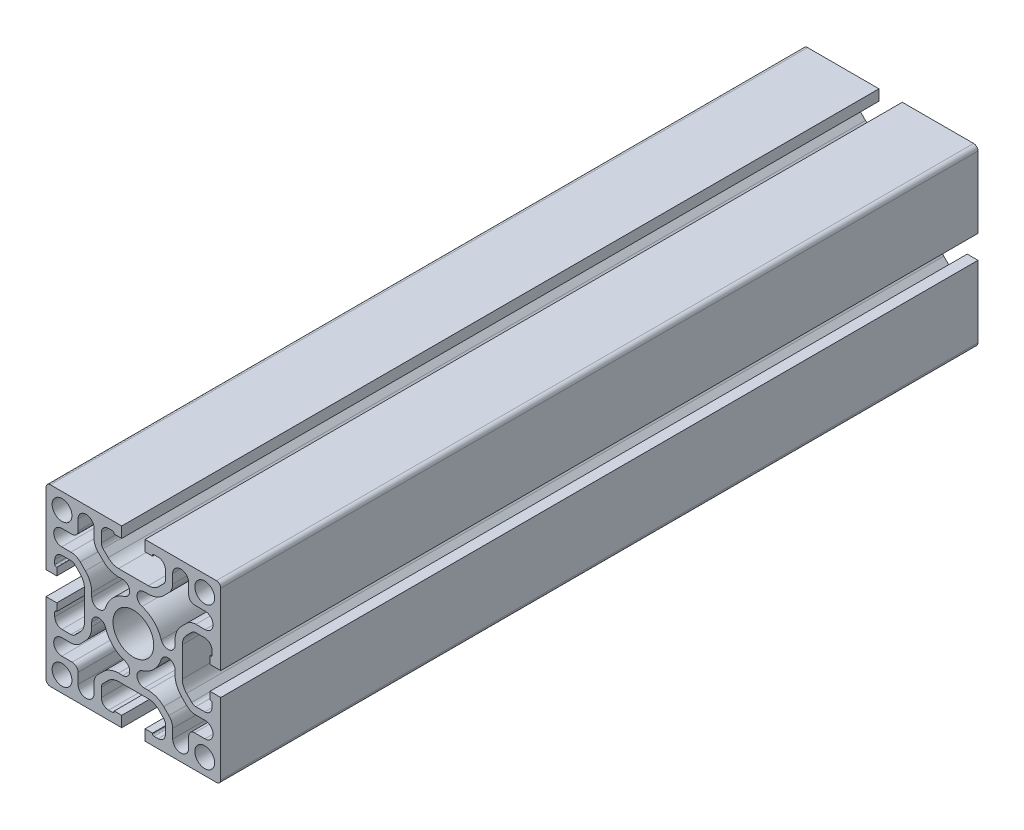
from build123d import *

# Parameters (mm, degrees)
SKETCH1_R           = 3.4
SKETCH1_R_2         = 7
BOSS_EXTRUDE1_DEPTH = 260


with BuildPart() as part:
    # Sketch1 → Boss-Extrude1 (new body)
    with BuildSketch(Plane(origin=(0, 0, 0), x_dir=(-1, 0, 0), z_dir=(0, 0, -1))):
        with BuildLine():
            Line((5.1, 16.8), (-5.11, 16.8))
            ThreePointArc((-5.11, 16.8), (-7.023417162, 17.180602337), (-8.645533906, 18.264466094))
            Line((-8.645533906, 18.264466094), (-10.42, 20.04))
            ThreePointArc((-10.42, 20.04), (-10.849063493, 20.687796578), (-11, 21.45))
            Line((-11, 21.45), (-11, 24.5))
            ThreePointArc((-11, 24.5), (-10.267766953, 26.267766953), (-8.5, 27))
            Line((-8.5, 27), (-7.07, 27))
            ThreePointArc((-7.07, 27), (-6.716446609, 26.853553391), (-6.57, 26.5))
            Line((-6.57, 26.5), (-6.57, 26.3))
            Line((-6.57, 26.3), (-4, 26.3))
            Line((-4, 26.3), (-4, 30))
            Line((-4, 30), (-28.5, 30))
            ThreePointArc((-28.5, 30), (-29.560660172, 29.560660172), (-30, 28.5))
            Line((-30, 28.5), (-30, 4))
            Line((-30, 4), (-26.3, 4))
            Line((-26.3, 4), (-26.3, 6.57))
            Line((-26.3, 6.57), (-26.500000003, 6.57))
            ThreePointArc((-26.500000003, 6.57), (-26.853553391, 6.716446609), (-27, 7.069999997))
            Line((-27, 7.069999997), (-27, 8.500000474))
            ThreePointArc((-27, 8.500000474), (-26.267767092, 10.267767092), (-24.500000474, 11))
            Line((-24.500000474, 11), (-21.45, 11))
            ThreePointArc((-21.45, 11), (-20.684633135, 10.847759065), (-20.035786438, 10.414213562))
            Line((-20.035786438, 10.414213562), (-18.27, 8.65))
            ThreePointArc((-18.27, 8.65), (-17.181928688, 7.026614358), (-16.8, 5.11))
            Line((-16.8, 5.11), (-16.8, -5.1))
            ThreePointArc((-16.8, -5.1), (-17.180602337, -7.013417162), (-18.264466094, -8.635533906))
            Line((-18.264466094, -8.635533906), (-20.04, -10.41))
            ThreePointArc((-20.04, -10.41), (-20.685169913, -10.847983768), (-21.45, -11))
            Line((-21.45, -11), (-24.5, -11))
            ThreePointArc((-24.5, -11), (-26.267766953, -10.267766953), (-27, -8.5))
            Line((-27, -8.5), (-27, -7.07))
            ThreePointArc((-27, -7.07), (-26.853553391, -6.716446609), (-26.5, -6.57))
            Line((-26.5, -6.57), (-26.3, -6.57))
            Line((-26.3, -6.57), (-26.3, -4))
            Line((-26.3, -4), (-30, -4))
            Line((-30, -4), (-30, -28.5))
            ThreePointArc((-30, -28.5), (-29.560660172, -29.560660172), (-28.5, -30))
            Line((-28.5, -30), (-4, -30))
            Line((-4, -30), (-4, -26.3))
            Line((-4, -26.3), (-6.57, -26.3))
            Line((-6.57, -26.3), (-6.57, -26.5))
            ThreePointArc((-6.57, -26.5), (-6.716446609, -26.853553391), (-7.07, -27))
            Line((-7.07, -27), (-8.5, -27))
            ThreePointArc((-8.5, -27), (-10.267766953, -26.267766953), (-11, -24.5))
            Line((-11, -24.5), (-11, -21.45))
            ThreePointArc((-11, -21.45), (-10.847759065, -20.684633135), (-10.414213562, -20.035786438))
            Line((-10.414213562, -20.035786438), (-8.65, -18.26))
            ThreePointArc((-8.65, -18.26), (-7.024002341, -17.180843639), (-5.11, -16.8))
            Line((-5.11, -16.8), (5.1, -16.8))
            ThreePointArc((5.1, -16.8), (7.014002341, -17.180843639), (8.64, -18.26))
            Line((8.64, -18.26), (10.41, -20.03))
            ThreePointArc((10.41, -20.03), (10.846363066, -20.681264642), (11, -21.45))
            Line((11, -21.45), (11, -24.5))
            ThreePointArc((11, -24.5), (10.267766953, -26.267766953), (8.5, -27))
            Line((8.5, -27), (7.07, -27))
            ThreePointArc((7.07, -27), (6.716446609, -26.853553391), (6.57, -26.5))
            Line((6.57, -26.5), (6.57, -26.3))
            Line((6.57, -26.3), (4, -26.3))
            Line((4, -26.3), (4, -30))
            Line((4, -30), (28.5, -30))
            ThreePointArc((28.5, -30), (29.560660172, -29.560660172), (30, -28.5))
            Line((30, -28.5), (30, -4))
            Line((30, -4), (26.3, -4))
            Line((26.3, -4), (26.3, -6.57))
            Line((26.3, -6.57), (26.5, -6.57))
            ThreePointArc((26.5, -6.57), (26.853553391, -6.716446609), (27, -7.07))
            Line((27, -7.07), (27, -8.5))
            ThreePointArc((27, -8.5), (26.267766953, -10.267766953), (24.5, -11))
            Line((24.5, -11), (21.45, -11))
            ThreePointArc((21.45, -11), (20.684633135, -10.847759065), (20.035786438, -10.414213562))
            Line((20.035786438, -10.414213562), (18.26, -8.64))
            ThreePointArc((18.26, -8.64), (17.180843639, -7.014002341), (16.8, -5.1))
            Line((16.8, -5.1), (16.8, 5.11))
            ThreePointArc((16.8, 5.11), (17.180843639, 7.024002341), (18.26, 8.65))
            Line((18.26, 8.65), (20.035786438, 10.414213562))
            ThreePointArc((20.035786438, 10.414213562), (20.684633135, 10.847759065), (21.45, 11))
            Line((21.45, 11), (24.5, 11))
            ThreePointArc((24.5, 11), (26.267766953, 10.267766953), (27, 8.5))
            Line((27, 8.5), (27, 7.07))
            ThreePointArc((27, 7.07), (26.853553391, 6.716446609), (26.5, 6.57))
            Line((26.5, 6.57), (26.3, 6.57))
            Line((26.3, 6.57), (26.3, 4))
            Line((26.3, 4), (30, 4))
            Line((30, 4), (30, 28.5))
            ThreePointArc((30, 28.5), (29.560660172, 29.560660172), (28.5, 30))
            Line((28.5, 30), (4, 30))
            Line((4, 30), (4, 26.3))
            Line((4, 26.3), (6.57, 26.3))
            Line((6.57, 26.3), (6.57, 26.5))
            ThreePointArc((6.57, 26.5), (6.71641961, 26.85358039), (7.07, 27))
            Line((7.07, 27), (8.5, 27))
            ThreePointArc((8.5, 27), (10.267766953, 26.267766953), (11, 24.5))
            Line((11, 24.5), (11, 21.45))
            ThreePointArc((11, 21.45), (10.847759065, 20.684633135), (10.414213562, 20.035786438))
            Line((10.414213562, 20.035786438), (8.64, 18.27))
            ThreePointArc((8.64, 18.27), (7.016614358, 17.181928688), (5.1, 16.8))
        make_face()
        with Locations(Location((-24.5, 24.5, 0), (0, 0, 180))):
            Circle(SKETCH1_R, mode=Mode.SUBTRACT)
        with Locations(Location((24.5, 24.5, 0), (0, 0, 180))):
            Circle(SKETCH1_R, mode=Mode.SUBTRACT)
        with Locations(Location((-24.5, -24.49, 0), (0, 0, 180))):
            Circle(SKETCH1_R, mode=Mode.SUBTRACT)
        with Locations(Location((24.5, -24.49, 0), (0, 0, 180))):
            Circle(SKETCH1_R, mode=Mode.SUBTRACT)
        with Locations(Location((0, 0, 0), (0, 0, 180))):
            Circle(SKETCH1_R_2, mode=Mode.SUBTRACT)
        with BuildLine():
            Line((5.103398282, -14.3), (3.678409373, -14.3))
            ThreePointArc((3.678409373, -14.3), (1.27735351, -12.23505015), (2.959678316, -9.551979076))
            ThreePointArc((2.959678316, -9.551979076), (7.071067812, -7.071067812), (9.551979076, -2.959678316))
            ThreePointArc((9.551979076, -2.959678316), (12.23505015, -1.27735351), (14.3, -3.678409373))
            Line((14.3, -3.678409373), (14.3, -5.11339393))
            ThreePointArc((14.3, -5.11339393), (14.86686796, -7.973757565), (16.481781365, -10.401734932))
            Line((16.481781365, -10.401734932), (18.243100081, -12.173004601))
            ThreePointArc((18.243100081, -12.173004601), (19.706101967, -13.155028322), (21.434031262, -13.5))
            Line((21.434031262, -13.5), (24.6, -13.5))
            ThreePointArc((24.6, -13.5), (27.35, -16.25), (24.6, -19))
            Line((24.6, -19), (21, -19))
            ThreePointArc((21, -19), (19.585786438, -19.585786438), (19, -21))
            Line((19, -21), (19, -24.6))
            ThreePointArc((19, -24.6), (16.25, -27.35), (13.5, -24.6))
            Line((13.5, -24.6), (13.5, -21.453961031))
            ThreePointArc((13.5, -21.453961031), (13.157457896, -19.731885585), (12.181980515, -18.271980515))
            Line((12.181980515, -18.271980515), (10.406699141, -16.496699141))
            ThreePointArc((10.406699141, -16.496699141), (7.973524025, -14.870903506), (5.103398282, -14.3))
        make_face(mode=Mode.SUBTRACT)
        with BuildLine():
            Line((-3.678409373, -14.3), (-5.103398282, -14.3))
            ThreePointArc((-5.103398282, -14.3), (-7.973524025, -14.870903506), (-10.406699141, -16.496699141))
            Line((-10.406699141, -16.496699141), (-12.181980515, -18.271980515))
            ThreePointArc((-12.181980515, -18.271980515), (-13.157457896, -19.731885585), (-13.5, -21.453961031))
            Line((-13.5, -21.453961031), (-13.5, -24.6))
            ThreePointArc((-13.5, -24.6), (-16.25, -27.35), (-19, -24.6))
            Line((-19, -24.6), (-19, -21))
            ThreePointArc((-19, -21), (-19.585786438, -19.585786438), (-21, -19))
            Line((-21, -19), (-24.6, -19))
            ThreePointArc((-24.6, -19), (-27.35, -16.25), (-24.6, -13.5))
            Line((-24.6, -13.5), (-21.434031262, -13.5))
            ThreePointArc((-21.434031262, -13.5), (-19.706101967, -13.155028322), (-18.243100081, -12.173004601))
            Line((-18.243100081, -12.173004601), (-16.481781365, -10.401734932))
            ThreePointArc((-16.481781365, -10.401734932), (-14.86686796, -7.973757565), (-14.3, -5.11339393))
            Line((-14.3, -5.11339393), (-14.3, -3.678409373))
            ThreePointArc((-14.3, -3.678409373), (-12.23505015, -1.27735351), (-9.551979076, -2.959678316))
            ThreePointArc((-9.551979076, -2.959678316), (-7.071067812, -7.071067812), (-2.959678316, -9.551979076))
            ThreePointArc((-2.959678316, -9.551979076), (-1.27735351, -12.23505015), (-3.678409373, -14.3))
        make_face(mode=Mode.SUBTRACT)
        with BuildLine():
            Line((-5.103398282, 14.3), (-3.678409373, 14.3))
            ThreePointArc((-3.678409373, 14.3), (-1.27735351, 12.23505015), (-2.959678316, 9.551979076))
            ThreePointArc((-2.959678316, 9.551979076), (-7.071067812, 7.071067812), (-9.551979076, 2.959678316))
            ThreePointArc((-9.551979076, 2.959678316), (-12.23505015, 1.27735351), (-14.3, 3.678409373))
            Line((-14.3, 3.678409373), (-14.3, 5.11339393))
            ThreePointArc((-14.3, 5.11339393), (-14.86686796, 7.973757565), (-16.481781365, 10.401734932))
            Line((-16.481781365, 10.401734932), (-18.243100081, 12.173004601))
            ThreePointArc((-18.243100081, 12.173004601), (-19.706101967, 13.155028322), (-21.434031262, 13.5))
            Line((-21.434031262, 13.5), (-24.6, 13.5))
            ThreePointArc((-24.6, 13.5), (-27.35, 16.25), (-24.6, 19))
            Line((-24.6, 19), (-21, 19))
            ThreePointArc((-21, 19), (-19.585786438, 19.585786438), (-19, 21))
            Line((-19, 21), (-19, 24.6))
            ThreePointArc((-19, 24.6), (-16.25, 27.35), (-13.5, 24.6))
            Line((-13.5, 24.6), (-13.5, 21.453961031))
            ThreePointArc((-13.5, 21.453961031), (-13.157457896, 19.731885585), (-12.181980515, 18.271980515))
            Line((-12.181980515, 18.271980515), (-10.406699141, 16.496699141))
            ThreePointArc((-10.406699141, 16.496699141), (-7.973524025, 14.870903506), (-5.103398282, 14.3))
        make_face(mode=Mode.SUBTRACT)
        with BuildLine():
            Line((3.678409373, 14.3), (5.103398282, 14.3))
            ThreePointArc((5.103398282, 14.3), (7.973524025, 14.870903506), (10.406699141, 16.496699141))
            Line((10.406699141, 16.496699141), (12.181980515, 18.271980515))
            ThreePointArc((12.181980515, 18.271980515), (13.157457896, 19.731885585), (13.5, 21.453961031))
            Line((13.5, 21.453961031), (13.5, 24.6))
            ThreePointArc((13.5, 24.6), (16.25, 27.35), (19, 24.6))
            Line((19, 24.6), (19, 21))
            ThreePointArc((19, 21), (19.585786438, 19.585786438), (21, 19))
            Line((21, 19), (24.6, 19))
            ThreePointArc((24.6, 19), (27.35, 16.25), (24.6, 13.5))
            Line((24.6, 13.5), (21.434031262, 13.5))
            ThreePointArc((21.434031262, 13.5), (19.706101967, 13.155028322), (18.243100081, 12.173004601))
            Line((18.243100081, 12.173004601), (16.481781365, 10.401734932))
            ThreePointArc((16.481781365, 10.401734932), (14.86686796, 7.973757565), (14.3, 5.11339393))
            Line((14.3, 5.11339393), (14.3, 3.678409373))
            ThreePointArc((14.3, 3.678409373), (12.23505015, 1.27735351), (9.551979076, 2.959678316))
            ThreePointArc((9.551979076, 2.959678316), (7.071067812, 7.071067812), (2.959678316, 9.551979076))
            ThreePointArc((2.959678316, 9.551979076), (1.27735351, 12.23505015), (3.678409373, 14.3))
        make_face(mode=Mode.SUBTRACT)
    extrude(amount=-BOSS_EXTRUDE1_DEPTH)


solid = part.part
